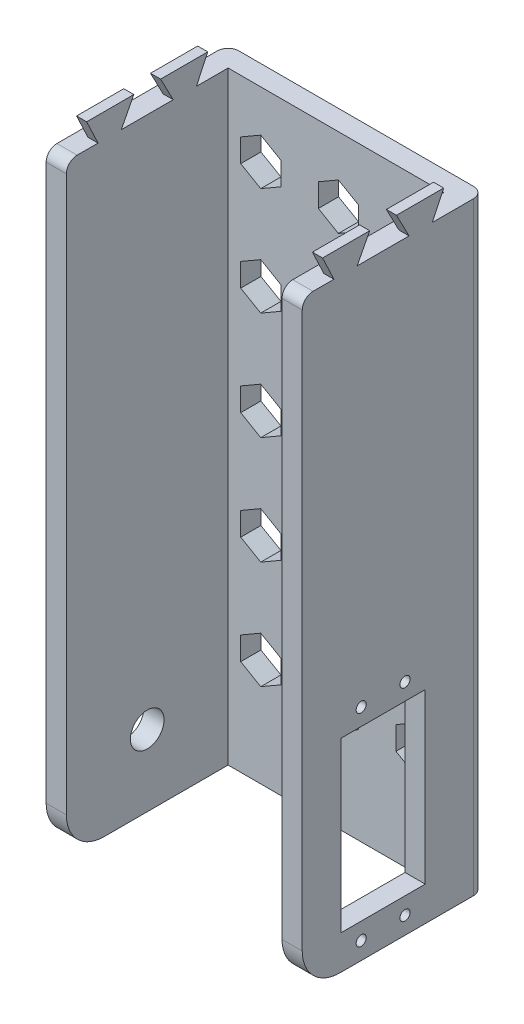
from build123d import *

# Parameters (mm, degrees)
BOSS_EXTRUDE1_DEPTH = 152.4
SKETCH2_R           = 1.190625
SKETCH2_W           = 19.84375
SKETCH2_H           = 39.6875
CUT_EXTRUDE1_DEPTH  = 6.35
CUT_EXTRUDE2_DEPTH  = 2.38125
CUT_EXTRUDE3_DEPTH  = 2.38125
BOSS_EXTRUDE2_DEPTH = 2.38125
BOSS_EXTRUDE3_DEPTH = 2.38125
FILLET1_R           = 2.54
SKETCH7_W           = 51.674409632
SKETCH7_H           = 14.688438898
CUT_EXTRUDE4_DEPTH  = 172.100000261
FILLET2_R           = 8.89
SKETCH8_R           = 3.96875
CUT_EXTRUDE5_DEPTH  = 170.479485102
CUT_EXTRUDE6_DEPTH  = 169.363218031


with BuildPart() as part:
    # Sketch1 → Boss-Extrude1 (new body)
    with BuildSketch(Plane(origin=(0, 0, 0), x_dir=(1, 0, 0), z_dir=(0, 1, 0))):
        Polygon((-38.941593287, 17.493761907), (21.383406713, 17.493761907), (21.383406713, -25.368738093), (16.620906713, -25.368738093), (16.620906713, 12.731261907), (-34.179093287, 12.731261907), (-34.179093287, -25.368738093), (-38.941593287, -25.368738093), align=None)
    extrude(amount=BOSS_EXTRUDE1_DEPTH)

    # Sketch2 → Cut-Extrude1 (cut)
    with BuildSketch(Plane(origin=(21.383406713, 0, 0), x_dir=(0, 0, -1), z_dir=(1, 0, 0))):
        with Locations((-11.478113093, 14.2875)):
            Circle(SKETCH2_R)
        with Locations((-1.159363093, 14.2875)):
            Circle(SKETCH2_R)
        with Locations((-1.159363093, 61.9125)):
            Circle(SKETCH2_R)
        with Locations((-11.478113093, 61.9125)):
            Circle(SKETCH2_R)
        with Locations((-6.318738093, 38.1)):
            Rectangle(SKETCH2_W, SKETCH2_H)
    extrude(amount=-CUT_EXTRUDE1_DEPTH, mode=Mode.SUBTRACT)

    # Sketch3 → Cut-Extrude2 (cut)
    with BuildSketch(Plane(origin=(21.383406713, 0, 0), x_dir=(0, 0, -1), z_dir=(1, 0, 0))):
        Polygon((-20.587285527, 5.690264064), (-9.47039523, 5.690264064), (-12.431175058, 0), (-17.905824551, 0), align=None)
        Polygon((-0.206301127, 0), (5.268348366, 0), (7.949809342, 5.690264064), (-3.167080955, 5.690264064), align=None)
    extrude(amount=-CUT_EXTRUDE2_DEPTH, mode=Mode.SUBTRACT)

    # Sketch4 → Cut-Extrude3 (cut)
    with BuildSketch(Plane(origin=(-34.179093287, 0, 0), x_dir=(0, 0, -1), z_dir=(1, 0, 0))):
        Polygon((-9.47039523, 5.690264064), (-20.587285527, 5.690264064), (-17.905824551, 0), (-12.431175058, 0), align=None)
        Polygon((5.268348366, 0), (7.949809342, 5.690264064), (-3.167080955, 5.690264064), (-0.206301127, 0), align=None)
    extrude(amount=-CUT_EXTRUDE3_DEPTH, mode=Mode.SUBTRACT)

    # Sketch5 → Boss-Extrude2 (add)
    with BuildSketch(Plane(origin=(21.383406713, 0, 0), x_dir=(0, 0, -1), z_dir=(1, 0, 0))):
        Polygon((-0.206301127, 152.4), (5.268348366, 152.4), (7.949809342, 158.090264064), (-3.167080955, 158.090264064), align=None)
        Polygon((-17.905824551, 152.4), (-12.431175058, 152.4), (-9.47039523, 158.090264064), (-20.587285527, 158.090264064), align=None)
    extrude(amount=-BOSS_EXTRUDE2_DEPTH)

    # Sketch6 → Boss-Extrude3 (add)
    with BuildSketch(Plane(origin=(-34.179093287, 0, 0), x_dir=(0, 0, -1), z_dir=(1, 0, 0))):
        Polygon((-17.905824551, 152.4), (-12.431175058, 152.4), (-9.47039523, 158.090264064), (-20.587285527, 158.090264064), align=None)
        Polygon((5.268348366, 152.4), (7.949809342, 158.090264064), (-3.167080955, 158.090264064), (-0.206301127, 152.4), align=None)
    extrude(amount=-BOSS_EXTRUDE3_DEPTH)

    # Fillet1
    fillet1_edges = [part.edges().sort_by_distance(p)[0] for p in [
        (-36.560343287, 0, 25.368738093),
        (-38.941593287, 76.2, -17.493761907),
        (21.383406713, 76.2, -17.493761907),
        (19.002156713, 152.4, 25.368738093),
        (-36.560343287, 152.4, 25.368738093),
        (19.002156713, 0, 25.368738093),
    ]]
    fillet(fillet1_edges, radius=FILLET1_R)

    # Sketch7 → Cut-Extrude4 (cut, through all)
    with BuildSketch(Plane(origin=(21.383406713, 0, 0), x_dir=(0, 0, -1), z_dir=(1, 0, 0))):
        with Locations((-4.704390425, 2.848923491)):
            Rectangle(SKETCH7_W, SKETCH7_H)
    extrude(amount=-CUT_EXTRUDE4_DEPTH, mode=Mode.SUBTRACT)

    # Fillet2
    fillet2_edges = [part.edges().sort_by_distance(p)[0] for p in [
        (-36.560343287, 10.19314294, 25.368738093),
        (19.002156713, 10.19314294, 25.368738093),
    ]]
    fillet(fillet2_edges, radius=FILLET2_R)

    # Sketch8 → Cut-Extrude5 (cut, through all)
    with BuildSketch(Plane(origin=(-34.179093287, 0, 0), x_dir=(0, 0, -1), z_dir=(1, 0, 0))):
        with Locations((-6.318738093, 26.9875)):
            Circle(SKETCH8_R)
    extrude(amount=-CUT_EXTRUDE5_DEPTH, mode=Mode.SUBTRACT)

    # Sketch9 → Cut-Extrude6 (cut, through all)
    with BuildSketch(Plane(origin=(0, 0, -17.493761907), x_dir=(-1, 0, 0), z_dir=(0, 0, -1))):
        Polygon((8.201765803, 131.642746086), (12.926215978, 134.370408666), (12.926215978, 139.825733827), (8.201765803, 142.553396407), (3.477315628, 139.825733827), (3.477315628, 134.370408666), align=None)
        Polygon((-10.086234197, 131.642746086), (-5.361784022, 134.370408666), (-5.361784022, 139.825733827), (-10.086234197, 142.553396407), (-14.810684372, 139.825733827), (-14.810684372, 134.370408666), align=None)
        Polygon((26.489765803, 131.642746086), (31.214215978, 134.370408666), (31.214215978, 139.825733827), (26.489765803, 142.553396407), (21.765315628, 139.825733827), (21.765315628, 134.370408666), align=None)
        Polygon((8.201765803, 106.242746086), (12.926215978, 108.970408666), (12.926215978, 114.425733827), (8.201765803, 117.153396407), (3.477315628, 114.425733827), (3.477315628, 108.970408666), align=None)
        Polygon((26.489765803, 106.242746086), (31.214215978, 108.970408666), (31.214215978, 114.425733827), (26.489765803, 117.153396407), (21.765315628, 114.425733827), (21.765315628, 108.970408666), align=None)
        Polygon((8.201765803, 80.842746086), (12.926215978, 83.570408666), (12.926215978, 89.025733827), (8.201765803, 91.753396407), (3.477315628, 89.025733827), (3.477315628, 83.570408666), align=None)
        Polygon((26.489765803, 80.842746086), (31.214215978, 83.570408666), (31.214215978, 89.025733827), (26.489765803, 91.753396407), (21.765315628, 89.025733827), (21.765315628, 83.570408666), align=None)
        Polygon((8.201765803, 55.442746086), (12.926215978, 58.170408666), (12.926215978, 63.625733827), (8.201765803, 66.353396407), (3.477315628, 63.625733827), (3.477315628, 58.170408666), align=None)
        Polygon((26.489765803, 55.442746086), (31.214215978, 58.170408666), (31.214215978, 63.625733827), (26.489765803, 66.353396407), (21.765315628, 63.625733827), (21.765315628, 58.170408666), align=None)
        Polygon((8.201765803, 30.042746086), (12.926215978, 32.770408666), (12.926215978, 38.225733827), (8.201765803, 40.953396407), (3.477315628, 38.225733827), (3.477315628, 32.770408666), align=None)
        Polygon((26.489765803, 30.042746086), (31.214215978, 32.770408666), (31.214215978, 38.225733827), (26.489765803, 40.953396407), (21.765315628, 38.225733827), (21.765315628, 32.770408666), align=None)
        Polygon((-10.086234197, 106.242746086), (-5.361784022, 108.970408666), (-5.361784022, 114.425733827), (-10.086234197, 117.153396407), (-14.810684372, 114.425733827), (-14.810684372, 108.970408666), align=None)
        Polygon((-10.086234197, 80.842746086), (-5.361784022, 83.570408666), (-5.361784022, 89.025733827), (-10.086234197, 91.753396407), (-14.810684372, 89.025733827), (-14.810684372, 83.570408666), align=None)
        Polygon((-10.086234197, 55.442746086), (-5.361784022, 58.170408666), (-5.361784022, 63.625733827), (-10.086234197, 66.353396407), (-14.810684372, 63.625733827), (-14.810684372, 58.170408666), align=None)
        Polygon((-10.086234197, 30.042746086), (-5.361784022, 32.770408666), (-5.361784022, 38.225733827), (-10.086234197, 40.953396407), (-14.810684372, 38.225733827), (-14.810684372, 32.770408666), align=None)
    extrude(amount=-CUT_EXTRUDE6_DEPTH, mode=Mode.SUBTRACT)


solid = part.part
